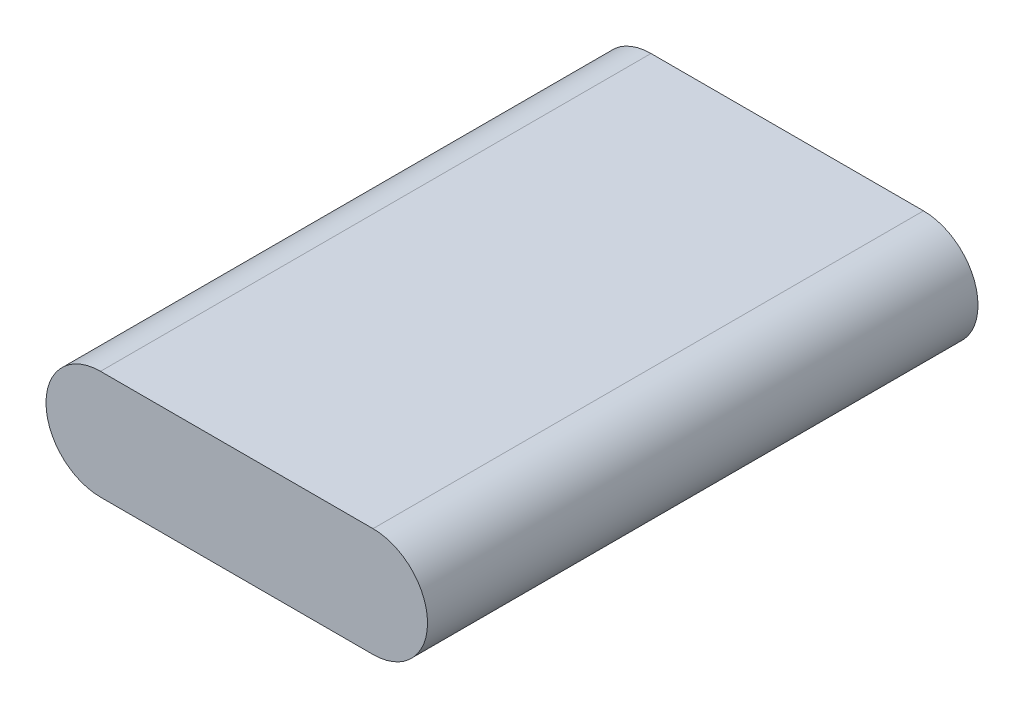
from build123d import *

# Parameters (mm, degrees)
EXTRUDE_2_DEPTH = 101


with BuildPart() as part:
    # 草图2 → 凸台-拉伸2 (new body)
    with BuildSketch(Plane.XY):
        with BuildLine():
            Line((-32.805038423, 10), (17.194961577, 10))
            ThreePointArc((17.194961577, 10), (27.194961577, 0), (17.194961577, -10))
            Line((17.194961577, -10), (-32.805038423, -10))
            ThreePointArc((-32.805038423, -10), (-42.805038423, 0), (-32.805038423, 10))
        make_face()
    extrude(amount=EXTRUDE_2_DEPTH)


solid = part.part
